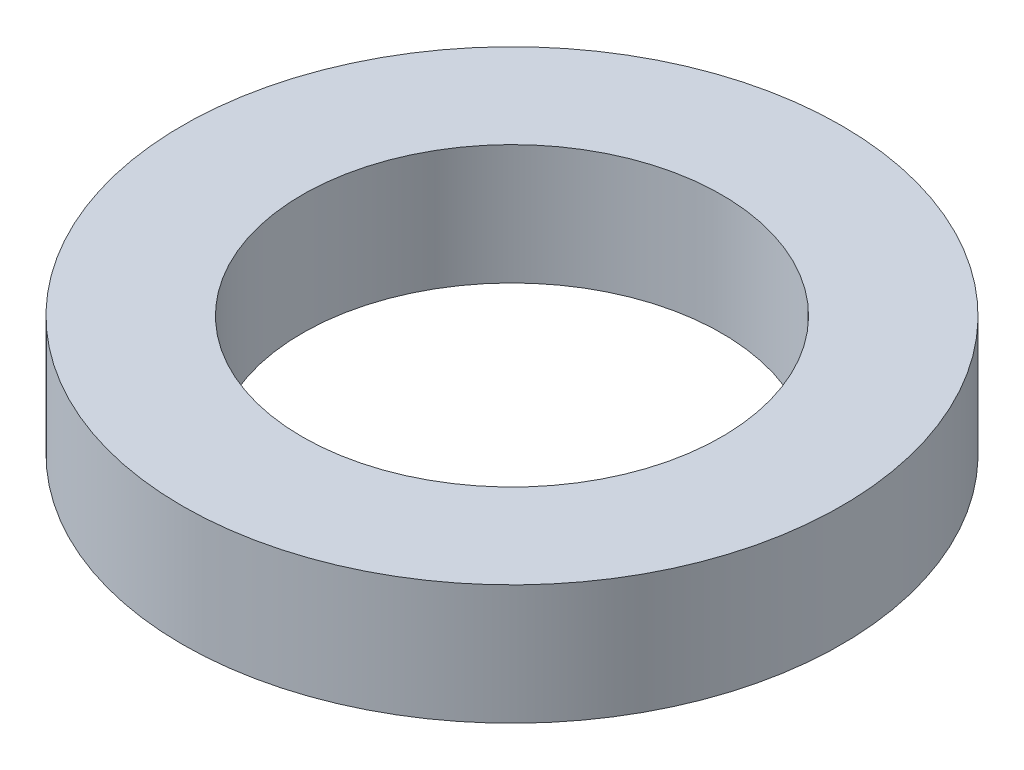
from build123d import *

# Parameters (mm, degrees)
CROQUIS1_R              = 2.75
CROQUIS1_R_2            = 1.75
SALIENTE_EXTRUIR1_DEPTH = 1


with BuildPart() as part:
    # Croquis1 → Saliente-Extruir1 (new body)
    with BuildSketch(Plane(origin=(0, 0, 0), x_dir=(1, 0, 0), z_dir=(0, 1, 0))):
        with Locations(Location((0, 0, 0), (0, 0, 270))):
            Circle(CROQUIS1_R)
        with Locations(Location((0, 0, 0), (0, 0, 270))):
            Circle(CROQUIS1_R_2, mode=Mode.SUBTRACT)
    extrude(amount=SALIENTE_EXTRUIR1_DEPTH)


solid = part.part
